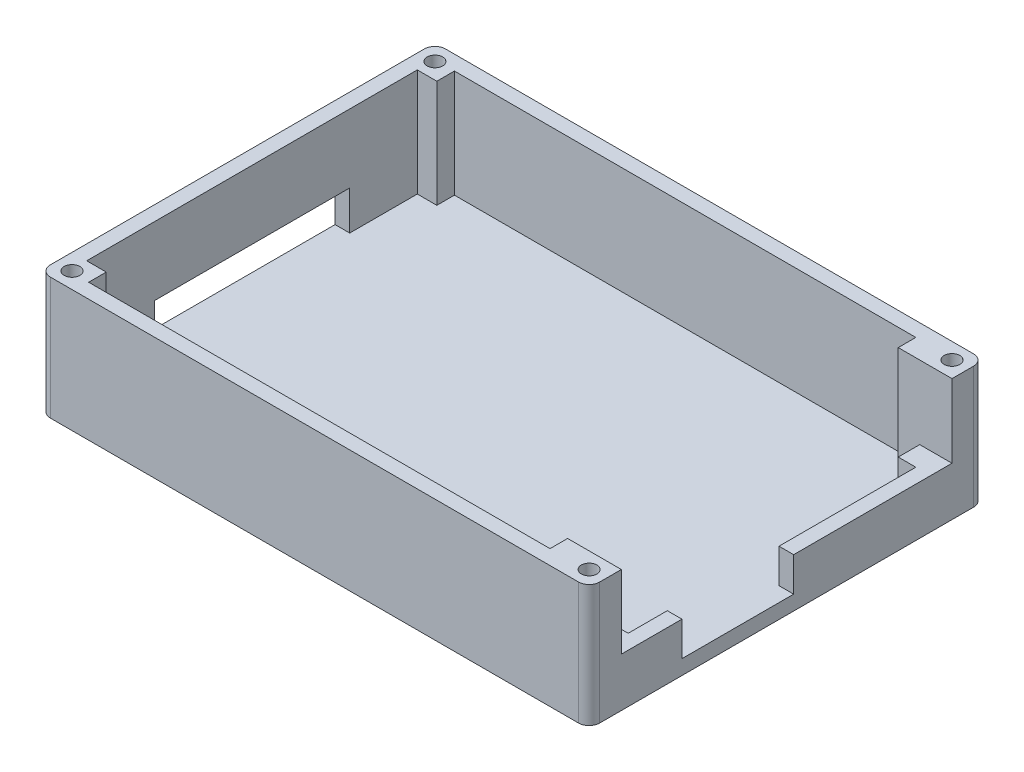
from build123d import *

# Parameters (mm, degrees)
SKETCH_1_W          = 56.21
SKETCH_1_H          = 40.43
EXTRUDE_1_DEPTH     = 1.5
SKETCH_2_W          = 54.71
SKETCH_2_H          = 1.5
EXTRUDE_2_DEPTH     = 3.5
SKETCH_3_W          = 1.5
SKETCH_3_H          = 8
SKETCH_3_H_2        = 18
EXTRUDE_3_DEPTH     = 3.5
SKETCH_4_W          = 2.2
SKETCH_4_H          = 1.8
EXTRUDE_4_DEPTH     = 3.5
SKETCH_5_W          = 2
SKETCH_5_H          = 1.8
EXTRUDE_5_DEPTH     = 3.5
EXTRUDE_9_DEPTH     = 7.5
SKETCH_9_R          = 0.8
CUT_EXTRUDE_1_DEPTH = 7.5
SKETCH_11_W         = 10
SKETCH_11_H         = 4
CUT_EXTRUDE_2_DEPTH = 7.5
CUT_EXTRUDE_3_DEPTH = 15


with BuildPart() as part:
    # 草图1 → 凸台-拉伸1 (new body)
    with BuildSketch(Plane(origin=(0, 0, 0), x_dir=(1, 0, 0), z_dir=(0, 1, 0))):
        with Locations((-10.770778443, 1.999730539)):
            Rectangle(SKETCH_1_W, SKETCH_1_H)
    extrude(amount=EXTRUDE_1_DEPTH)

    # 草图2 → 凸台-拉伸2 (add)
    with BuildSketch(Plane(origin=(0, 1.5, 0), x_dir=(1, 0, 0), z_dir=(0, 1, 0))):
        Polygon((-37.375778443, 22.214730539), (-38.875778443, 22.214730539), (-38.875778443, -18.215269461), (-37.375778443, -18.215269461), (-37.375778443, -16.715269461), (-37.375778443, 20.714730539), align=None)
        with Locations((-10.020778443, 21.464730539)):
            Rectangle(SKETCH_2_W, SKETCH_2_H)
        with Locations((-10.020778443, -17.465269461)):
            Rectangle(SKETCH_2_W, SKETCH_2_H)
    extrude(amount=EXTRUDE_2_DEPTH)

    # 草图3 → 凸台-拉伸3 (add)
    with BuildSketch(Plane(origin=(0, 1.5, 0), x_dir=(1, 0, 0), z_dir=(0, 1, 0))):
        with Locations((16.584221557, -12.715269461)):
            Rectangle(SKETCH_3_W, SKETCH_3_H)
        with Locations((16.584221557, 11.714730539)):
            Rectangle(SKETCH_3_W, SKETCH_3_H_2)
    extrude(amount=EXTRUDE_3_DEPTH)

    # 草图4 → 凸台-拉伸4 (add)
    with BuildSketch(Plane(origin=(0, 1.5, 0), x_dir=(1, 0, 0), z_dir=(0, 1, 0))):
        with Locations((12.934221557, 19.814730539)):
            Rectangle(SKETCH_4_W, SKETCH_4_H)
        Polygon((15.834221557, 16.714730539), (15.834221557, 20.714730539), (14.034221557, 20.714730539), (14.034221557, 18.914730539), (14.034221557, 16.714730539), align=None)
        Polygon((14.034221557, -16.715269461), (15.834221557, -16.715269461), (15.834221557, -12.715269461), (14.034221557, -12.715269461), (14.034221557, -14.915269461), align=None)
        with Locations((12.934221557, -15.815269461)):
            Rectangle(SKETCH_4_W, SKETCH_4_H)
    extrude(amount=EXTRUDE_4_DEPTH)

    # 草图5 → 凸台-拉伸5 (add)
    with BuildSketch(Plane(origin=(0, 1.5, 0), x_dir=(1, 0, 0), z_dir=(0, 1, 0))):
        with Locations((-36.375778443, 19.814730539)):
            Rectangle(SKETCH_5_W, SKETCH_5_H)
        with Locations((-36.375778443, -15.815269461)):
            Rectangle(SKETCH_5_W, SKETCH_5_H)
    extrude(amount=EXTRUDE_5_DEPTH)

    # 草图8 → 凸台-拉伸9 (add)
    with BuildSketch(Plane(origin=(0, 5, 0), x_dir=(1, 0, 0), z_dir=(0, 1, 0))):
        Polygon((17.334221557, -14.915269461), (14.034221557, -14.915269461), (11.834221557, -14.915269461), (11.834221557, -16.715269461), (-35.375778443, -16.715269461), (-35.375778443, -14.915269461), (-37.375778443, -14.915269461), (-37.375778443, 18.914730539), (-35.375778443, 18.914730539), (-35.375778443, 20.714730539), (11.834221557, 20.714730539), (11.834221557, 18.914730539), (14.034221557, 18.914730539), (17.334221557, 18.914730539), (17.334221557, 22.214730539), (-38.875778443, 22.214730539), (-38.875778443, -18.215269461), (17.334221557, -18.215269461), align=None)
    extrude(amount=EXTRUDE_9_DEPTH)

    # 草图9 → 切除-拉伸1 (cut)
    with BuildSketch(Plane(origin=(0, 12.5, 0), x_dir=(1, 0, 0), z_dir=(0, 1, 0))):
        with Locations(Location((15.684221557, 20.564730539, 0), (0, 0, 270))):
            Circle(SKETCH_9_R)
        with Locations(Location((15.684221557, -16.565269461, 0), (0, 0, 270))):
            Circle(SKETCH_9_R)
        with Locations(Location((-37.225778443, 20.564730539, 0), (0, 0, 270))):
            Circle(SKETCH_9_R)
        with Locations(Location((-37.225778443, -16.565269461, 0), (0, 0, 270))):
            Circle(SKETCH_9_R)
    extrude(amount=-CUT_EXTRUDE_1_DEPTH, mode=Mode.SUBTRACT)

    # 草图11 → 切除-拉伸2 (cut)
    with BuildSketch(Plane(origin=(-37.375778443, 0, 0), x_dir=(0, 0, -1), z_dir=(1, 0, 0))):
        with Locations((6.999730539, 3.5)):
            Rectangle(SKETCH_11_W, SKETCH_11_H)
        with Locations((-3.000269461, 3.5)):
            Rectangle(SKETCH_11_W, SKETCH_11_H)
    extrude(amount=-CUT_EXTRUDE_2_DEPTH, mode=Mode.SUBTRACT)

    # 草图14 → 切除-拉伸3 (cut)
    with BuildSketch(Plane(origin=(0, 12.5, 0), x_dir=(1, 0, 0), z_dir=(0, 1, 0))):
        with BuildLine():
            Line((-38.875778443, 22.214730539), (-38.875778443, 21.130415964))
            ThreePointArc((-38.875778443, 21.130415964), (-38.558190057, 21.897142153), (-37.791463868, 22.214730539))
            Line((-37.791463868, 22.214730539), (-38.875778443, 22.214730539))
        make_face()
        with BuildLine():
            ThreePointArc((-37.791463868, -18.215269461), (-38.558190057, -17.897681075), (-38.875778443, -17.130954886))
            Line((-38.875778443, -17.130954886), (-38.875778443, -18.215269461))
            Line((-38.875778443, -18.215269461), (-37.791463868, -18.215269461))
        make_face()
        with BuildLine():
            ThreePointArc((17.334221557, -17.130954886), (17.016633171, -17.897681075), (16.249906982, -18.215269461))
            Line((16.249906982, -18.215269461), (17.334221557, -18.215269461))
            Line((17.334221557, -18.215269461), (17.334221557, -17.130954886))
        make_face()
        with BuildLine():
            Line((17.334221557, 22.214730539), (16.249906982, 22.214730539))
            ThreePointArc((16.249906982, 22.214730539), (17.016633171, 21.897142153), (17.334221557, 21.130415964))
            Line((17.334221557, 21.130415964), (17.334221557, 22.214730539))
        make_face()
    extrude(amount=-CUT_EXTRUDE_3_DEPTH, mode=Mode.SUBTRACT)


solid = part.part
